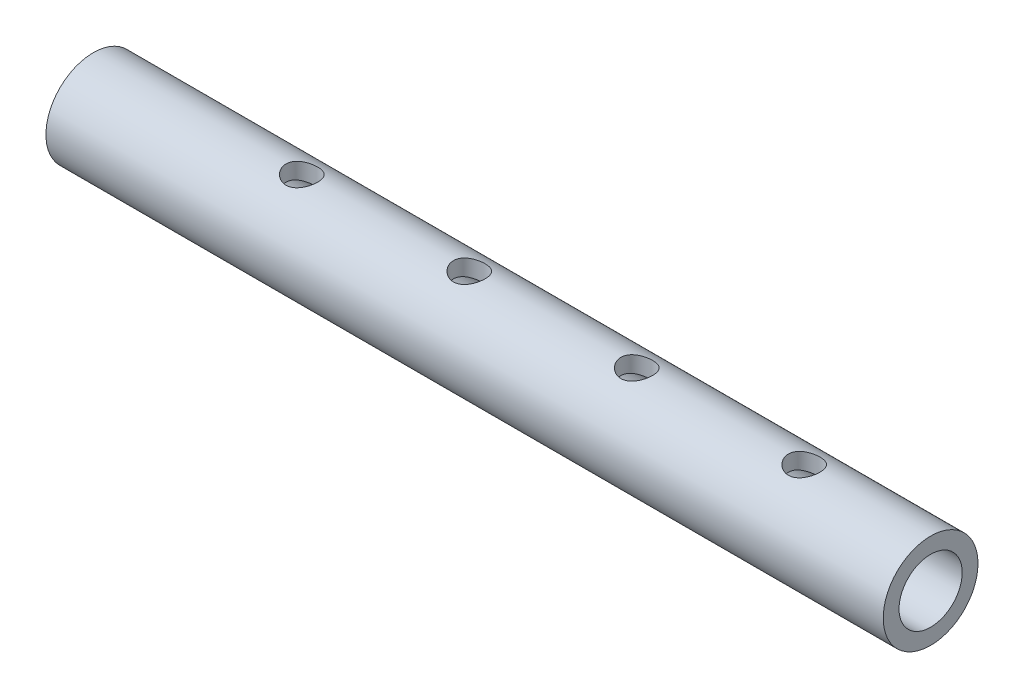
from build123d import *

# Parameters (mm, degrees)
SWEEP_THIN1_PROFILE_R   = 15
SWEEP_THIN1_PROFILE_R_2 = 10
CUT_EXTRUDE1_DEPTH      = 371.070563812
CUT_EXTRUDE1_DEPTH_BACK = 371.070563812
SKETCH3_R               = 5


with BuildPart() as part:
    # Sweep-Thin1: sweep along a path in Sketch2
    with BuildLine(Plane(origin=(0, 0, 0), x_dir=(1, 0, 0), z_dir=(0, 1, 0))) as sweep_thin1_path:
        Line((49.169098098, 180), (314.169098098, 180))
    # Sweep-Thin1 profile (on start of the path) → Sweep-Thin1 (sweep)
    with BuildSketch(Plane(origin=(49.169098098, 0, -180), x_dir=(0, 0, 1), z_dir=(1, 0, 0))):
        Circle(SWEEP_THIN1_PROFILE_R)
        Circle(SWEEP_THIN1_PROFILE_R_2, mode=Mode.SUBTRACT)
    sweep(path=sweep_thin1_path.line)

    # Sketch3 → Cut-Extrude1 (cut, two sides: drawn at the far end of the back side and taken through both)
    with BuildSketch(Plane(origin=(0, 0, 0), x_dir=(1, 0, 0), z_dir=(0, 1, 0)).offset(-CUT_EXTRUDE1_DEPTH_BACK)):
        with Locations(Location((115.169098098, 180, 0), (0, 0, 270))):
            Circle(SKETCH3_R)
        with Locations(Location((168.169098098, 180, 0), (0, 0, 270))):
            Circle(SKETCH3_R)
        with Locations(Location((221.169098098, 180, 0), (0, 0, 270))):
            Circle(SKETCH3_R)
        with Locations(Location((274.169098098, 180, 0), (0, 0, 270))):
            Circle(SKETCH3_R)
    extrude(amount=CUT_EXTRUDE1_DEPTH + CUT_EXTRUDE1_DEPTH_BACK, mode=Mode.SUBTRACT)


solid = part.part
